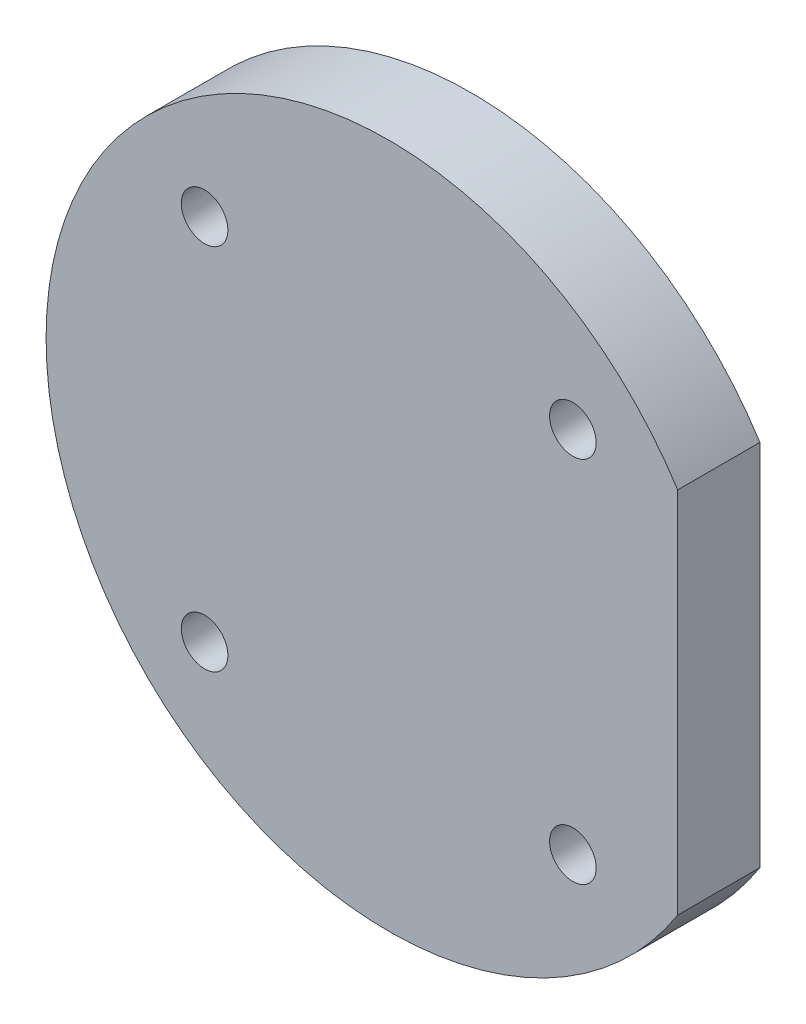
from build123d import *

# Parameters (mm, degrees)
ESQUISSE1_R             = 25
ESQUISSE1_R_2           = 1.7
BOSS_EXTRU_1_DEPTH      = 6
ESQUISSE6_R             = 11
ENL_V_MAT_EXTRU_2_DEPTH = 3
CONG_2_R                = 0.5
BOSS_EXTRU_6_DEPTH      = 6
ESQUISSE12_RX           = 3.57944127
ESQUISSE12_RY           = 3
ENL_V_MAT_EXTRU_3_DEPTH = 15
ESQUISSE13_W            = 18.660647855
ESQUISSE13_H            = 1.5
ESQUISSE14_W            = 18.40878356
ESQUISSE14_H            = 1.5
ESQUISSE15_W            = 7.963879273
ESQUISSE15_H            = 27.450042448
ENL_V_MAT_EXTRU_4_DEPTH = 36.860842729


with BuildPart() as part:
    # Esquisse1 → Boss.-Extru.1 (new body)
    with BuildSketch(Plane.XY):
        Circle(ESQUISSE1_R)
        with Locations((-13.435028843, 13.435028843)):
            Circle(ESQUISSE1_R_2, mode=Mode.SUBTRACT)
        with Locations((13.435028843, 13.435028843)):
            Circle(ESQUISSE1_R_2, mode=Mode.SUBTRACT)
        with Locations((13.435028843, -13.435028843)):
            Circle(ESQUISSE1_R_2, mode=Mode.SUBTRACT)
        with Locations((-13.435028843, -13.435028843)):
            Circle(ESQUISSE1_R_2, mode=Mode.SUBTRACT)
    extrude(amount=BOSS_EXTRU_1_DEPTH)

    # Esquisse6 → Enlèv. mat.-Extru.2 (cut)
    with BuildSketch(Plane(origin=(0, 0, 0), x_dir=(-1, 0, 0), z_dir=(0, 0, -1))):
        Circle(ESQUISSE6_R)
    extrude(amount=-ENL_V_MAT_EXTRU_2_DEPTH, mode=Mode.SUBTRACT)

    # Congé2
    cong_2_edges = [part.edges().sort_by_distance(p)[0] for p in [
        (11, 0, 3),
    ]]
    fillet(cong_2_edges, radius=CONG_2_R)

    # Esquisse10 → Boss.-Extru.6 (add)
    with BuildSketch(Plane.XY.offset(6)):
        with BuildLine():
            Line((-5.758802096, -2.316766812), (-9.508802096, -5.566766812))
            ThreePointArc((-9.508802096, -5.566766812), (-10.566766812, -5.491197904), (-10.491197904, -4.433233188))
            Line((-10.491197904, -4.433233188), (-6.741197904, -1.183233188))
            ThreePointArc((-6.741197904, -1.183233188), (-5.683233188, -1.258802096), (-5.758802096, -2.316766812))
        make_face()
        with BuildLine():
            Line((-6.741197904, 1.183233188), (-10.491197904, 4.433233188))
            ThreePointArc((-10.491197904, 4.433233188), (-10.566766812, 5.491197904), (-9.508802096, 5.566766812))
            Line((-9.508802096, 5.566766812), (-5.758802096, 2.316766812))
            ThreePointArc((-5.758802096, 2.316766812), (-5.683233188, 1.258802096), (-6.741197904, 1.183233188))
        make_face()
        with BuildLine():
            Line((9.508802096, -5.566766812), (5.758802096, -2.316766812))
            ThreePointArc((5.758802096, -2.316766812), (5.683233188, -1.258802096), (6.741197904, -1.183233188))
            Line((6.741197904, -1.183233188), (10.491197904, -4.433233188))
            ThreePointArc((10.491197904, -4.433233188), (10.566766812, -5.491197904), (9.508802096, -5.566766812))
        make_face()
        with BuildLine():
            Line((10.491197904, 4.433233188), (6.741197904, 1.183233188))
            ThreePointArc((6.741197904, 1.183233188), (5.683233188, 1.258802096), (5.758802096, 2.316766812))
            Line((5.758802096, 2.316766812), (9.508802096, 5.566766812))
            ThreePointArc((9.508802096, 5.566766812), (10.566766812, 5.491197904), (10.491197904, 4.433233188))
        make_face()
    extrude(amount=-BOSS_EXTRU_6_DEPTH)

    # Esquisse12 → Enlèv. mat.-Extru.3 (cut)
    with BuildSketch(Plane.ZY.offset(25)):
        with Locations(Location((0, 0), (0, 0, 180))):
            Ellipse(ESQUISSE12_RX, ESQUISSE12_RY)
    extrude(amount=-ENL_V_MAT_EXTRU_3_DEPTH, mode=Mode.SUBTRACT)

    # Esquisse13 → Enlèvement de matière-Révolution1 (revolve, cut)
    with BuildSketch(Plane(origin=(0, 0, 0), x_dir=(-1, 0, 0), z_dir=(0, 0, -1))):
        with Locations((15.635249349, 6.304475395)):
            Rectangle(ESQUISSE13_W, ESQUISSE13_H)
    revolve(axis=Axis((-24.965573276, 7.054475395, 0), (1, 0, 0)), mode=Mode.SUBTRACT)

    # Esquisse14 → Enlèvement de matière-Révolution2 (revolve, cut)
    with BuildSketch(Plane(origin=(0, 0, 0), x_dir=(-1, 0, 0), z_dir=(0, 0, -1))):
        with Locations((15.170755462, -6.304475395)):
            Rectangle(ESQUISSE14_W, ESQUISSE14_H)
    revolve(axis=Axis((-24.375147242, -7.054475395, 0), (1, 0, 0)), mode=Mode.SUBTRACT)

    # Esquisse15 → Enlèv. mat.-Extru.4 (cut, through all)
    with BuildSketch(Plane(origin=(0, 0, 0), x_dir=(-1, 0, 0), z_dir=(0, 0, -1))):
        with Locations((-25.065108278, -0.289992381)):
            Rectangle(ESQUISSE15_W, ESQUISSE15_H)
    extrude(amount=-ENL_V_MAT_EXTRU_4_DEPTH, mode=Mode.SUBTRACT)


solid = part.part
